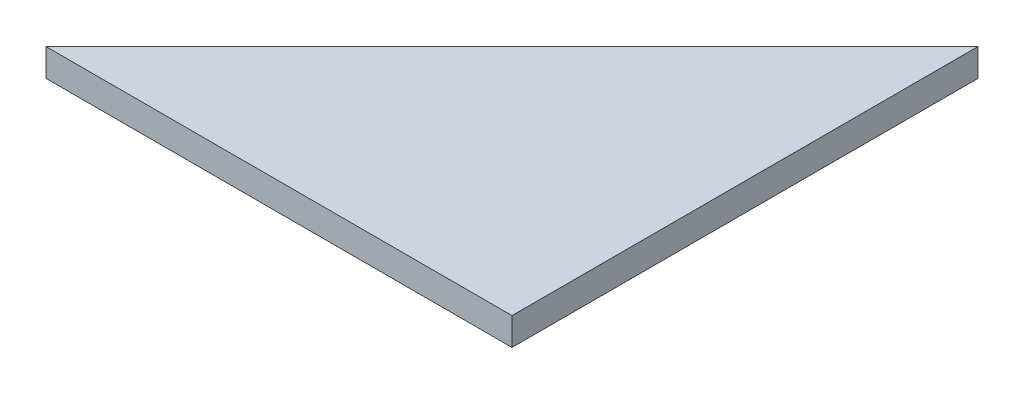
from build123d import *

# Parameters (mm, degrees)
BOSS_EXTRUDE1_DEPTH = 3.175


with BuildPart() as part:
    # Sketch1 → Boss-Extrude1 (new body)
    with BuildSketch(Plane(origin=(0, 0, 0), x_dir=(1, 0, 0), z_dir=(0, 1, 0))):
        Polygon((0, 0), (53.640001, 53.640001), (53.640001, 0), align=None)
    extrude(amount=BOSS_EXTRUDE1_DEPTH)


solid = part.part
